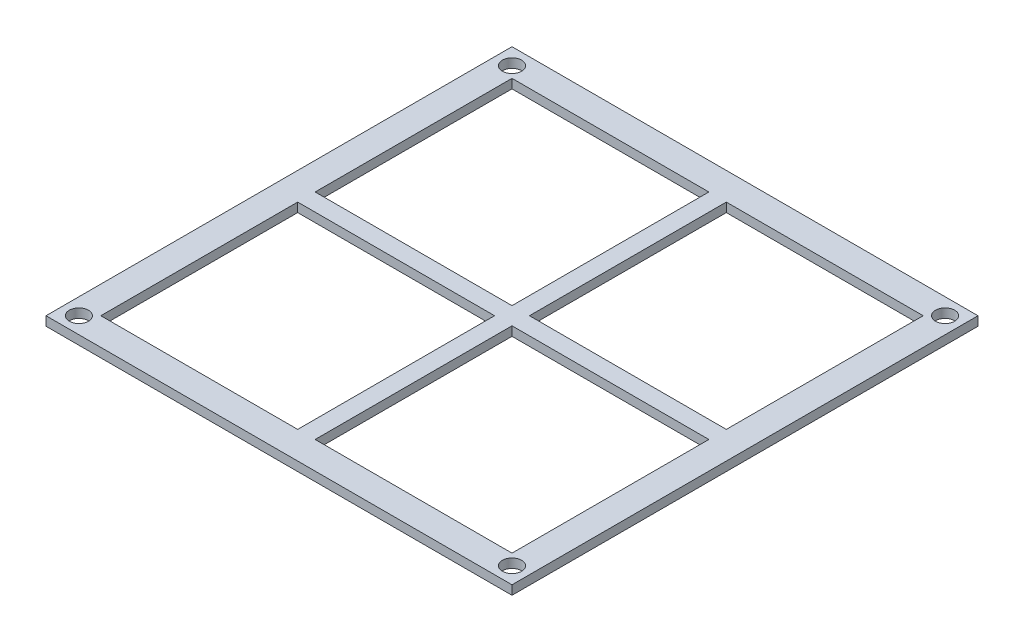
from build123d import *

# Parameters (mm, degrees)
SKETCH1_W           = 129.54
SKETCH1_H           = 129.54
SKETCH1_R           = 2.667
SKETCH1_W_2         = 114.3
SKETCH1_H_2         = 114.3
SKETCH1_H_3         = 4.852699468
SKETCH1_W_3         = 4.852699468
BOSS_EXTRUDE1_DEPTH = 2.54


with BuildPart() as part:
    # Sketch1 → Boss-Extrude1 (new body)
    # profile 1 of 3: a face of its own
    with BuildSketch(Plane(origin=(0, 0, 0), x_dir=(1, 0, 0), z_dir=(0, 1, 0))):
        Rectangle(SKETCH1_W, SKETCH1_H)
        with Locations(Location((-60.198, -60.198, 0), (0, 0, 270))):
            Circle(SKETCH1_R, mode=Mode.SUBTRACT)
        with Locations(Location((60.198, -60.198, 0), (0, 0, 270))):
            Circle(SKETCH1_R, mode=Mode.SUBTRACT)
        with Locations(Location((-60.198, 60.198, 0), (0, 0, 270))):
            Circle(SKETCH1_R, mode=Mode.SUBTRACT)
        with Locations(Location((60.198, 60.198, 0), (0, 0, 270))):
            Circle(SKETCH1_R, mode=Mode.SUBTRACT)
        Rectangle(SKETCH1_W_2, SKETCH1_H_2, mode=Mode.SUBTRACT)
    # profile 2 of 3: a face of its own
    with BuildSketch(Plane(origin=(0, 0, 0), x_dir=(1, 0, 0), z_dir=(0, 1, 0))):
        Rectangle(SKETCH1_W, SKETCH1_H_3)
    # profile 3 of 3: a face of its own
    with BuildSketch(Plane(origin=(0, 0, 0), x_dir=(1, 0, 0), z_dir=(0, 1, 0))):
        Rectangle(SKETCH1_W_3, SKETCH1_H)
    extrude(amount=BOSS_EXTRUDE1_DEPTH)


solid = part.part
